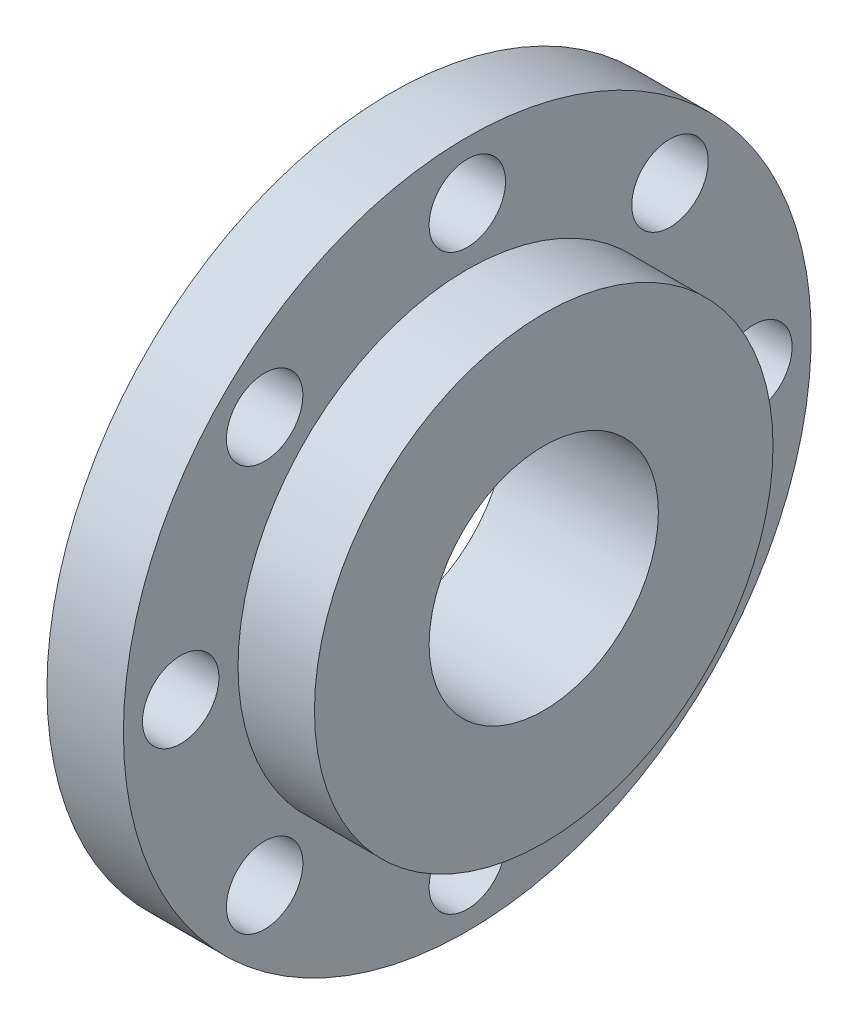
from build123d import *

# Parameters (mm, degrees)
SKETCH3_R          = 5
CUT_EXTRUDE1_DEPTH = 67.708320321


with BuildPart() as part:
    # Sketch2 → Revolve1 (revolve)
    with BuildSketch(Plane.XY, mode=Mode.PRIVATE) as revolve1_sk:
        Polygon((0, 15), (20, 15), (20, 30), (10, 30), (10, 45), (0, 45), align=None)
    revolve(revolve1_sk.sketch.rotate(Axis((0, 0, 0), (1, 0, 0)), 90), axis=Axis((0, 0, 0), (1, 0, 0)))

    # Sketch3 → Cut-Extrude1 (cut, through all)
    with BuildSketch(Plane.ZY):
        with Locations((0, 37.5)):
            Circle(SKETCH3_R)
        with Locations((26.516504294, 26.516504294)):
            Circle(SKETCH3_R)
        with Locations((37.5, 0)):
            Circle(SKETCH3_R)
        with Locations((26.516504294, -26.516504294)):
            Circle(SKETCH3_R)
        with Locations((0, -37.5)):
            Circle(SKETCH3_R)
        with Locations((-26.516504294, -26.516504294)):
            Circle(SKETCH3_R)
        with Locations((-37.5, 0)):
            Circle(SKETCH3_R)
        with Locations((-26.516504294, 26.516504294)):
            Circle(SKETCH3_R)
    extrude(amount=-CUT_EXTRUDE1_DEPTH, mode=Mode.SUBTRACT)


solid = part.part
